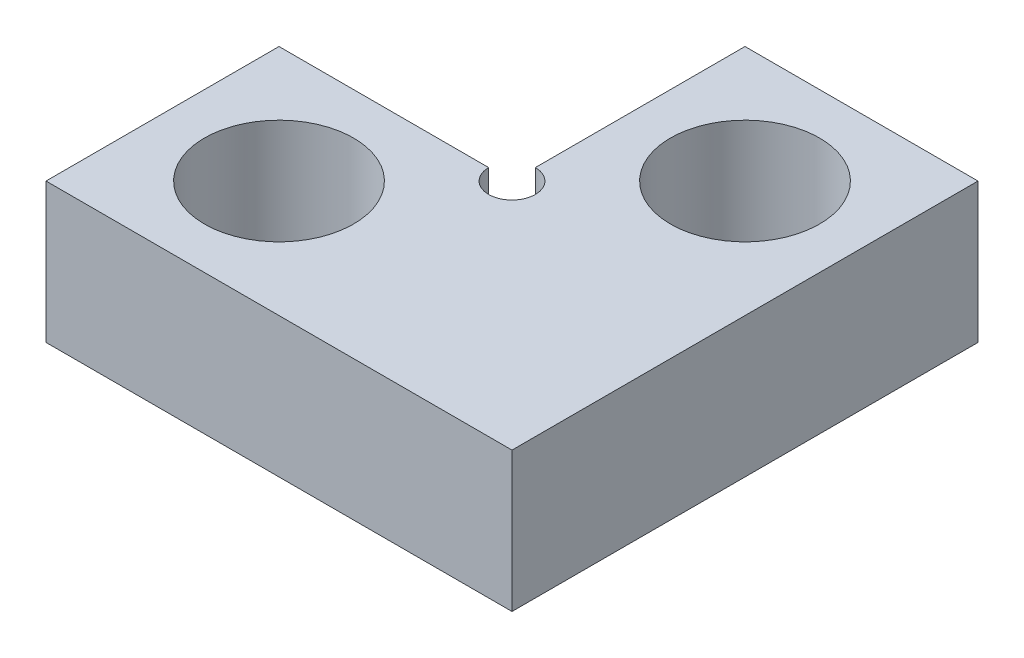
from build123d import *

# Parameters (mm, degrees)
CROQUIS1_R              = 1.6
SALIENTE_EXTRUIR1_DEPTH = 3


with BuildPart() as part:
    # Croquis1 → Saliente-Extruir1 (new body)
    with BuildSketch(Plane(origin=(0, 0, 0), x_dir=(1, 0, 0), z_dir=(0, 1, 0))):
        with BuildLine():
            Line((-0.5, 0), (-5, 0))
            Line((-5, 0), (-5, -5))
            Line((-5, -5), (5, -5))
            Line((5, -5), (5, 5))
            Line((5, 5), (0, 5))
            Line((0, 5), (0, 0.5))
            ThreePointArc((0, 0.5), (0.353553391, -0.353553391), (-0.5, 0))
        make_face()
        with Locations(Location((-2.5, -2.5, 0), (0, 0, 270))):
            Circle(CROQUIS1_R, mode=Mode.SUBTRACT)
        with Locations(Location((2.5, 2.5, 0), (0, 0, 270))):
            Circle(CROQUIS1_R, mode=Mode.SUBTRACT)
    extrude(amount=SALIENTE_EXTRUIR1_DEPTH)


solid = part.part
